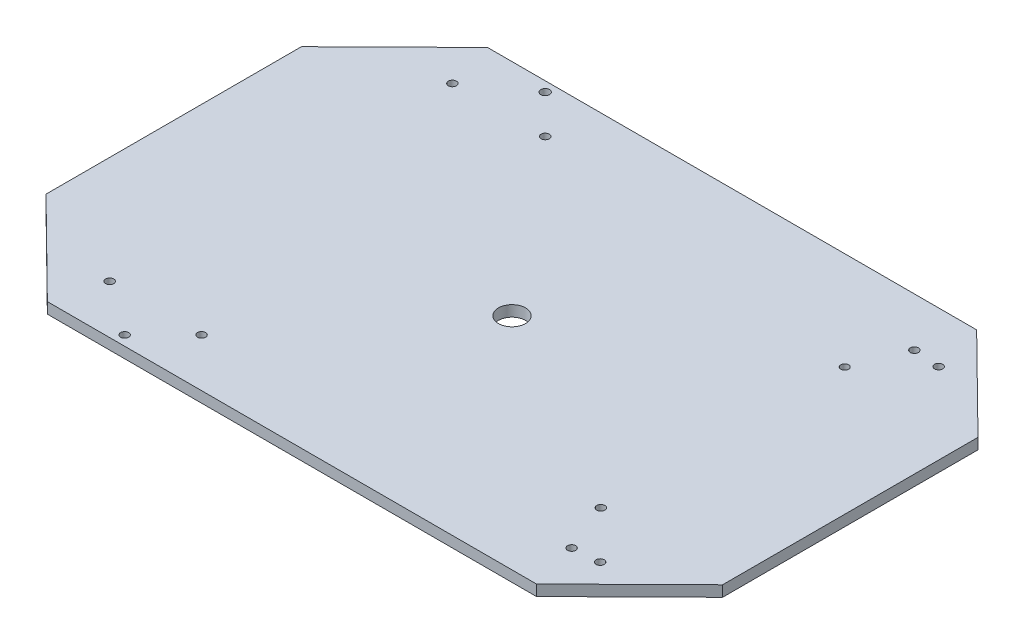
from build123d import *

# Parameters (mm, degrees)
SALIENTE_EXTRUIR1_DEPTH = 4
CROQUIS2_R              = 1.5
CORTAR_EXTRUIR1_DEPTH   = 10
CROQUIS3_R              = 1.5
CROQUIS3_R_2            = 1.439143575
CORTAR_EXTRUIR2_DEPTH   = 10
CROQUIS4_R              = 1.620915762
CROQUIS4_R_2            = 1.5
CORTAR_EXTRUIR3_DEPTH   = 50
CROQUIS5_R              = 5
CORTAR_EXTRUIR4_DEPTH   = 10


with BuildPart() as part:
    # Croquis1 → Saliente-Extruir1 (new body)
    with BuildSketch(Plane(origin=(0, 0, 0), x_dir=(1, 0, 0), z_dir=(0, 1, 0))):
        Polygon((-90, 81), (-124.5, 47), (-124.5, -47), (-90, -81), (0, -81), (90, -81), (124.5, -47), (124.5, 47), (90, 81), (0, 81), align=None)
    extrude(amount=SALIENTE_EXTRUIR1_DEPTH)

    # Croquis2 → Cortar-Extruir1 (cut)
    with BuildSketch(Plane(origin=(0, 4, 0), x_dir=(1, 0, 0), z_dir=(0, 1, 0))):
        with Locations(Location((-85, 63.060809699, 0), (0, 0, 270))):
            Circle(CROQUIS2_R)
        with Locations(Location((-85, -63.060809699, 0), (0, 0, 270))):
            Circle(CROQUIS2_R)
        with Locations(Location((85, -63.060809699, 0), (0, 0, 270))):
            Circle(CROQUIS2_R)
        with Locations(Location((85, 63.060809699, 0), (0, 0, 270))):
            Circle(CROQUIS2_R)
    extrude(amount=-CORTAR_EXTRUIR1_DEPTH, mode=Mode.SUBTRACT)

    # Croquis3 → Cortar-Extruir2 (cut)
    with BuildSketch(Plane(origin=(0, 4, 0), x_dir=(1, 0, 0), z_dir=(0, 1, 0))):
        with Locations(Location((94.732844127, -62.29571743, 0), (0, 0, 270))):
            Circle(CROQUIS3_R)
        with Locations(Location((77.563491473, -44.873874295, 0), (0, 0, 270))):
            Circle(CROQUIS3_R)
        with Locations(Location((77.563491473, 44.873874295, 0), (0, 0, 270))):
            Circle(CROQUIS3_R_2)
        with Locations(Location((94.732844127, 62.29571743, 0), (0, 0, 270))):
            Circle(CROQUIS3_R)
    extrude(amount=-CORTAR_EXTRUIR2_DEPTH, mode=Mode.SUBTRACT)

    # Croquis4 → Cortar-Extruir3 (cut)
    with BuildSketch(Plane.XZ):
        with Locations(Location((-65.16861846, -77.381821896, 0), (0, 0, 270))):
            Circle(CROQUIS4_R)
        with Locations(Location((-51.026482836, -63.239686272, 0), (0, 0, 270))):
            Circle(CROQUIS4_R_2)
        with Locations(Location((-65.16861846, 77.381821896, 0), (0, 0, 270))):
            Circle(CROQUIS4_R_2)
        with Locations(Location((-51.026482836, 63.239686272, 0), (0, 0, 270))):
            Circle(CROQUIS4_R_2)
    extrude(amount=-CORTAR_EXTRUIR3_DEPTH, mode=Mode.SUBTRACT)

    # Croquis5 → Cortar-Extruir4 (cut)
    with BuildSketch(Plane(origin=(0, 4, 0), x_dir=(1, 0, 0), z_dir=(0, 1, 0))):
        with Locations(Location((0, 0, 0), (0, 0, 270))):
            Circle(CROQUIS5_R)
    extrude(amount=-CORTAR_EXTRUIR4_DEPTH, mode=Mode.SUBTRACT)


solid = part.part
